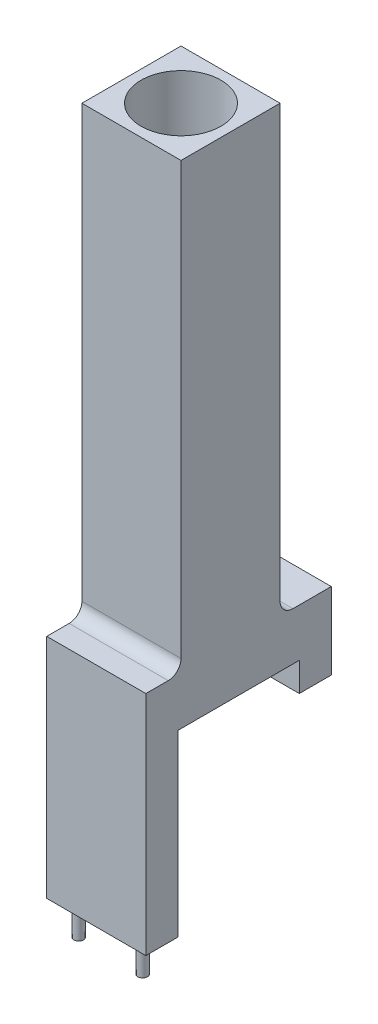
from build123d import *

# Parameters (mm, degrees)
BOSS_EXTRUDE1_DEPTH = 31
SKETCH3_R           = 12.5
CUT_EXTRUDE1_DEPTH  = 158.78787816
SKETCH4_W           = 31
SKETCH4_H           = 15
BOSS_EXTRUDE2_DEPTH = 11
SKETCH5_W           = 31
SKETCH5_H           = 10
BOSS_EXTRUDE3_DEPTH = 56
SKETCH6_R           = 1.5
BOSS_EXTRUDE4_DEPTH = 10
SKETCH7_W           = 31
SKETCH7_H           = 15
BOSS_EXTRUDE5_DEPTH = 16
SKETCH8_W           = 31
SKETCH8_H           = 10
BOSS_EXTRUDE6_DEPTH = 9
FILLET1_R           = 4


with BuildPart() as part:
    # Sketch1 → Boss-Extrude1 (new body)
    with BuildSketch(Plane.XY):
        with BuildLine():
            Line((-15.5, 182.5), (-15.5, 28.565713714))
            ThreePointArc((-15.5, 28.565713714), (0, 32.5), (15.5, 28.565713714))
            Line((15.5, 28.565713714), (15.5, 182.5))
            Line((15.5, 182.5), (-15.5, 182.5))
        make_face()
    extrude(amount=BOSS_EXTRUDE1_DEPTH)

    # Sketch3 → Cut-Extrude1 (cut, through all)
    with BuildSketch(Plane(origin=(0, 182.5, 0), x_dir=(1, 0, 0), z_dir=(0, 1, 0))):
        with Locations(Location((0, -15.5, 0), (0, 0, 270))):
            Circle(SKETCH3_R)
    extrude(amount=-CUT_EXTRUDE1_DEPTH, mode=Mode.SUBTRACT)

    # Sketch4 → Boss-Extrude2 (add)
    with BuildSketch(Plane.XY.offset(31)):
        with Locations((0, 36.065713714)):
            Rectangle(SKETCH4_W, SKETCH4_H)
    extrude(amount=BOSS_EXTRUDE2_DEPTH)

    # Sketch5 → Boss-Extrude3 (add)
    with BuildSketch(Plane.XZ.offset(-28.565713714)):
        with Locations((0, 37)):
            Rectangle(SKETCH5_W, SKETCH5_H)
    extrude(amount=BOSS_EXTRUDE3_DEPTH)

    # Sketch6 → Boss-Extrude4 (add)
    with BuildSketch(Plane.XZ.offset(27.434286286)):
        with Locations(Location((-10, 37.5, 0), (0, 0, 270))):
            Circle(SKETCH6_R)
        with Locations(Location((10, 37.5, 0), (0, 0, 270))):
            Circle(SKETCH6_R)
    extrude(amount=BOSS_EXTRUDE4_DEPTH)

    # Sketch7 → Boss-Extrude5 (add)
    with BuildSketch(Plane(origin=(0, 0, 0), x_dir=(-1, 0, 0), z_dir=(0, 0, -1))):
        with Locations((0, 36.065713714)):
            Rectangle(SKETCH7_W, SKETCH7_H)
    extrude(amount=BOSS_EXTRUDE5_DEPTH)

    # Sketch8 → Boss-Extrude6 (add)
    with BuildSketch(Plane.XZ.offset(-28.565713714)):
        with Locations((0, -11)):
            Rectangle(SKETCH8_W, SKETCH8_H)
    extrude(amount=BOSS_EXTRUDE6_DEPTH)

    # Fillet1
    fillet1_edges = [part.edges().sort_by_distance(p)[0] for p in [
        (0, 43.565713714, 31),
        (0, 43.565713714, 0),
    ]]
    fillet(fillet1_edges, radius=FILLET1_R)


solid = part.part
